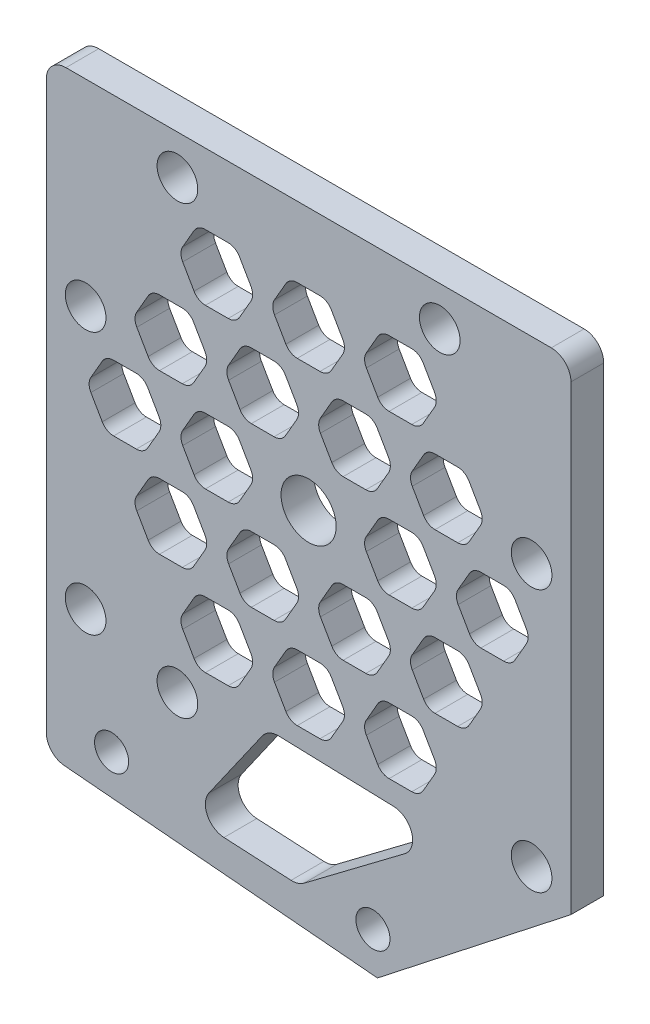
from build123d import *

# Parameters (mm, degrees)
SKETCH_1_W          = 40
SKETCH_1_H          = 40
SKETCH_1_R          = 1.55
EXTRUDE_1_DEPTH     = 2.5
EXTRUDE_2_DEPTH     = 2.5
SKETCH_3_R          = 1.3
CUT_EXTRUDE_1_DEPTH = 36.746691779
SKETCH_4_R          = 1.55
CUT_EXTRUDE_2_DEPTH = 36.746691779
SKETCH_5_R          = 2.1
CUT_EXTRUDE_3_DEPTH = 36.746691779
FILLET_1_R          = 1.5
CUT_EXTRUDE_4_DEPTH = 36.746691779
CUT_EXTRUDE_6_DEPTH = 35.688463717
FILLET_3_R          = 1


with BuildPart() as part:
    # 草图1 → 凸台-拉伸1 (new body)
    with BuildSketch(Plane.XY):
        Rectangle(SKETCH_1_W, SKETCH_1_H)
        with Locations((-17, 5)):
            Circle(SKETCH_1_R, mode=Mode.SUBTRACT)
        with Locations((-17, -15)):
            Circle(SKETCH_1_R, mode=Mode.SUBTRACT)
        with Locations(Location((17, -15, 0), (0, 0, 180))):
            Circle(SKETCH_1_R, mode=Mode.SUBTRACT)
        with Locations(Location((17, 5, 0), (0, 0, 180))):
            Circle(SKETCH_1_R, mode=Mode.SUBTRACT)
    extrude(amount=EXTRUDE_1_DEPTH)

    # 草图2 → 凸台-拉伸2 (add)
    with BuildSketch(Plane.XY.offset(2.5)):
        Polygon((20, -23.499546541), (20, -20), (-20, -20), (-20, -26.022919025), (20, -29.522465566), align=None)
    extrude(amount=-EXTRUDE_2_DEPTH)

    # 草图3 → 切除-拉伸1 (cut, through all)
    with BuildSketch(Plane.XY.offset(2.5)):
        with Locations((-15.01902651, -23.447238226)):
            Circle(SKETCH_3_R)
        with Locations((4.904867452, -25.190353081)):
            Circle(SKETCH_3_R)
    extrude(amount=-CUT_EXTRUDE_1_DEPTH, mode=Mode.SUBTRACT)

    # 草图4 → 切除-拉伸2 (cut, through all)
    with BuildSketch(Plane(origin=(0, 0, 0), x_dir=(-1, 0, 0), z_dir=(0, 0, -1))):
        with Locations((10, -17)):
            Circle(SKETCH_4_R)
        with Locations((10, 17)):
            Circle(SKETCH_4_R)
        with Locations(Location((-10, 17, 0), (0, 0, 180))):
            Circle(SKETCH_4_R)
    extrude(amount=-CUT_EXTRUDE_2_DEPTH, mode=Mode.SUBTRACT)

    # 草图5 → 切除-拉伸3 (cut, through all)
    with BuildSketch(Plane(origin=(0, 0, 0), x_dir=(-1, 0, 0), z_dir=(0, 0, -1))):
        Circle(SKETCH_5_R)
        Polygon((-10.739003765, -16.416979755), (0.791900827, -25.104463479), (9.154470492, -24.660735293), (3.078807634, -15.990969191), align=None)
    extrude(amount=-CUT_EXTRUDE_3_DEPTH, mode=Mode.SUBTRACT)

    # 圆角1
    fillet_1_edges = [part.edges().sort_by_distance(p)[0] for p in [
        (-20, -26.022919025, 1.25),
        (10.739003765, -16.416979755, 1.25),
        (-3.078807634, -15.990969191, 1.25),
        (-9.154470492, -24.660735293, 1.25),
        (-0.791900827, -25.104463479, 1.25),
        (-20, 20, 1.25),
        (20, 20, 1.25),
    ]]
    fillet(fillet_1_edges, radius=FILLET_1_R)

    # 草图6 → 切除-拉伸4 (cut, through all)
    with BuildSketch(Plane(origin=(0, 0, 0), x_dir=(-1, 0, 0), z_dir=(0, 0, -1))):
        Polygon((-20, -29.522465566), (-5.248633958, -28.231888266), (-20, -16.673627939), align=None)
    extrude(amount=-CUT_EXTRUDE_4_DEPTH, mode=Mode.SUBTRACT)

    # 草图8 → 切除-拉伸6 (cut, through all)
    with BuildSketch(Plane(origin=(0, 0, 0), x_dir=(-1, 0, 0), z_dir=(0, 0, -1))):
        Polygon((-5.556624327, 14.624355653), (-8.443375673, 14.624355653), (-9.886751346, 12.124355653), (-8.443375673, 9.624355653), (-5.556624327, 9.624355653), (-4.113248654, 12.124355653), align=None)
        Polygon((1.443375673, 14.624355653), (-1.443375673, 14.624355653), (-2.886751346, 12.124355653), (-1.443375673, 9.624355653), (1.443375673, 9.624355653), (2.886751346, 12.124355653), align=None)
        Polygon((8.443375673, 14.624355653), (5.556624327, 14.624355653), (4.113248654, 12.124355653), (5.556624327, 9.624355653), (8.443375673, 9.624355653), (9.886751346, 12.124355653), align=None)
        Polygon((-9.056624327, 8.562177826), (-11.943375673, 8.562177826), (-13.386751346, 6.062177826), (-11.943375673, 3.562177826), (-9.056624327, 3.562177826), (-7.613248654, 6.062177826), align=None)
        Polygon((-12.556624327, 2.5), (-15.443375673, 2.5), (-16.886751346, 0), (-15.443375673, -2.5), (-12.556624327, -2.5), (-11.113248654, 0), align=None)
        Polygon((-2.056624327, 8.562177826), (-4.943375673, 8.562177826), (-6.386751346, 6.062177826), (-4.943375673, 3.562177826), (-2.056624327, 3.562177826), (-0.613248654, 6.062177826), align=None)
        Polygon((4.943375673, 8.562177826), (2.056624327, 8.562177826), (0.613248654, 6.062177826), (2.056624327, 3.562177826), (4.943375673, 3.562177826), (6.386751346, 6.062177826), align=None)
        Polygon((11.943375673, 8.562177826), (9.056624327, 8.562177826), (7.613248654, 6.062177826), (9.056624327, 3.562177826), (11.943375673, 3.562177826), (13.386751346, 6.062177826), align=None)
        Polygon((-5.556624327, 2.5), (-8.443375673, 2.5), (-9.886751346, 0), (-8.443375673, -2.5), (-5.556624327, -2.5), (-4.113248654, 0), align=None)
        Polygon((8.443375673, 2.5), (5.556624327, 2.5), (4.113248654, 0), (5.556624327, -2.5), (8.443375673, -2.5), (9.886751346, 0), align=None)
        Polygon((15.443375673, 2.5), (12.556624327, 2.5), (11.113248654, 0), (12.556624327, -2.5), (15.443375673, -2.5), (16.886751346, 0), align=None)
        Polygon((-7.613248654, -6.062177826), (-9.056624327, -8.562177826), (-11.943375673, -8.562177826), (-13.386751346, -6.062177826), (-11.943375673, -3.562177826), (-9.056624327, -3.562177826), align=None)
        Polygon((-0.613248654, -6.062177826), (-2.056624327, -8.562177826), (-4.943375673, -8.562177826), (-6.386751346, -6.062177826), (-4.943375673, -3.562177826), (-2.056624327, -3.562177826), align=None)
        Polygon((6.386751346, -6.062177826), (4.943375673, -8.562177826), (2.056624327, -8.562177826), (0.613248654, -6.062177826), (2.056624327, -3.562177826), (4.943375673, -3.562177826), align=None)
        Polygon((13.386751346, -6.062177826), (11.943375673, -8.562177826), (9.056624327, -8.562177826), (7.613248654, -6.062177826), (9.056624327, -3.562177826), (11.943375673, -3.562177826), align=None)
        Polygon((9.886751346, -12.124355653), (8.443375673, -14.624355653), (5.556624327, -14.624355653), (4.113248654, -12.124355653), (5.556624327, -9.624355653), (8.443375673, -9.624355653), align=None)
        Polygon((2.886751346, -12.124355653), (1.443375673, -14.624355653), (-1.443375673, -14.624355653), (-2.886751346, -12.124355653), (-1.443375673, -9.624355653), (1.443375673, -9.624355653), align=None)
        Polygon((-4.113248654, -12.124355653), (-5.556624327, -14.624355653), (-8.443375673, -14.624355653), (-9.886751346, -12.124355653), (-8.443375673, -9.624355653), (-5.556624327, -9.624355653), align=None)
    extrude(amount=-CUT_EXTRUDE_6_DEPTH, mode=Mode.SUBTRACT)

    # 圆角3
    fillet_3_edges = [part.edges().sort_by_distance(p)[0] for p in [
        (2.056624327, -3.562177826, 1.25),
        (0.613248654, -6.062177826, 1.25),
        (2.056624327, -8.562177826, 1.25),
        (4.943375673, -8.562177826, 1.25),
        (6.386751346, -6.062177826, 1.25),
        (4.943375673, -3.562177826, 1.25),
        (-15.443375673, 2.5, 1.25),
        (-16.886751346, 0, 1.25),
        (-15.443375673, -2.5, 1.25),
        (-12.556624327, -2.5, 1.25),
        (-11.113248654, 0, 1.25),
        (-12.556624327, 2.5, 1.25),
        (-8.443375673, 2.5, 1.25),
        (-9.886751346, 0, 1.25),
        (-8.443375673, -2.5, 1.25),
        (-5.556624327, -2.5, 1.25),
        (-4.113248654, 0, 1.25),
        (-5.556624327, 2.5, 1.25),
        (9.056624327, -3.562177826, 1.25),
        (7.613248654, -6.062177826, 1.25),
        (9.056624327, -8.562177826, 1.25),
        (11.943375673, -8.562177826, 1.25),
        (13.386751346, -6.062177826, 1.25),
        (11.943375673, -3.562177826, 1.25),
        (-4.943375673, -3.562177826, 1.25),
        (-6.386751346, -6.062177826, 1.25),
        (-4.943375673, -8.562177826, 1.25),
        (-2.056624327, -8.562177826, 1.25),
        (-0.613248654, -6.062177826, 1.25),
        (-2.056624327, -3.562177826, 1.25),
        (-11.943375673, -3.562177826, 1.25),
        (-13.386751346, -6.062177826, 1.25),
        (-11.943375673, -8.562177826, 1.25),
        (-9.056624327, -8.562177826, 1.25),
        (-7.613248654, -6.062177826, 1.25),
        (-9.056624327, -3.562177826, 1.25),
        (-8.443375673, -9.624355653, 1.25),
        (-9.886751346, -12.124355653, 1.25),
        (-8.443375673, -14.624355653, 1.25),
        (-5.556624327, -14.624355653, 1.25),
        (-4.113248654, -12.124355653, 1.25),
        (-5.556624327, -9.624355653, 1.25),
        (-1.443375673, -9.624355653, 1.25),
        (-2.886751346, -12.124355653, 1.25),
        (-1.443375673, -14.624355653, 1.25),
        (1.443375673, -14.624355653, 1.25),
        (2.886751346, -12.124355653, 1.25),
        (1.443375673, -9.624355653, 1.25),
        (2.056624327, 8.562177826, 1.25),
        (0.613248654, 6.062177826, 1.25),
        (2.056624327, 3.562177826, 1.25),
        (4.943375673, 3.562177826, 1.25),
        (6.386751346, 6.062177826, 1.25),
        (4.943375673, 8.562177826, 1.25),
        (-8.443375673, 14.624355653, 1.25),
        (-9.886751346, 12.124355653, 1.25),
        (-8.443375673, 9.624355653, 1.25),
        (-5.556624327, 9.624355653, 1.25),
        (-4.113248654, 12.124355653, 1.25),
        (-5.556624327, 14.624355653, 1.25),
        (9.056624327, 8.562177826, 1.25),
        (7.613248654, 6.062177826, 1.25),
        (9.056624327, 3.562177826, 1.25),
        (11.943375673, 3.562177826, 1.25),
        (13.386751346, 6.062177826, 1.25),
        (11.943375673, 8.562177826, 1.25),
        (5.556624327, 14.624355653, 1.25),
        (4.113248654, 12.124355653, 1.25),
        (5.556624327, 9.624355653, 1.25),
        (8.443375673, 9.624355653, 1.25),
        (9.886751346, 12.124355653, 1.25),
        (8.443375673, 14.624355653, 1.25),
        (12.556624327, 2.5, 1.25),
        (11.113248654, 0, 1.25),
        (12.556624327, -2.5, 1.25),
        (15.443375673, -2.5, 1.25),
        (16.886751346, 0, 1.25),
        (15.443375673, 2.5, 1.25),
        (5.556624327, 2.5, 1.25),
        (4.113248654, 0, 1.25),
        (5.556624327, -2.5, 1.25),
        (8.443375673, -2.5, 1.25),
        (9.886751346, 0, 1.25),
        (8.443375673, 2.5, 1.25),
        (-4.943375673, 8.562177826, 1.25),
        (-6.386751346, 6.062177826, 1.25),
        (-4.943375673, 3.562177826, 1.25),
        (-2.056624327, 3.562177826, 1.25),
        (-0.613248654, 6.062177826, 1.25),
        (-2.056624327, 8.562177826, 1.25),
        (-11.943375673, 8.562177826, 1.25),
        (-13.386751346, 6.062177826, 1.25),
        (-11.943375673, 3.562177826, 1.25),
        (-9.056624327, 3.562177826, 1.25),
        (-7.613248654, 6.062177826, 1.25),
        (-9.056624327, 8.562177826, 1.25),
        (5.556624327, -9.624355653, 1.25),
        (4.113248654, -12.124355653, 1.25),
        (5.556624327, -14.624355653, 1.25),
        (8.443375673, -14.624355653, 1.25),
        (9.886751346, -12.124355653, 1.25),
        (8.443375673, -9.624355653, 1.25),
        (-1.443375673, 14.624355653, 1.25),
        (-2.886751346, 12.124355653, 1.25),
        (-1.443375673, 9.624355653, 1.25),
        (1.443375673, 9.624355653, 1.25),
        (2.886751346, 12.124355653, 1.25),
        (1.443375673, 14.624355653, 1.25),
    ]]
    fillet(fillet_3_edges, radius=FILLET_3_R)


solid = part.part
